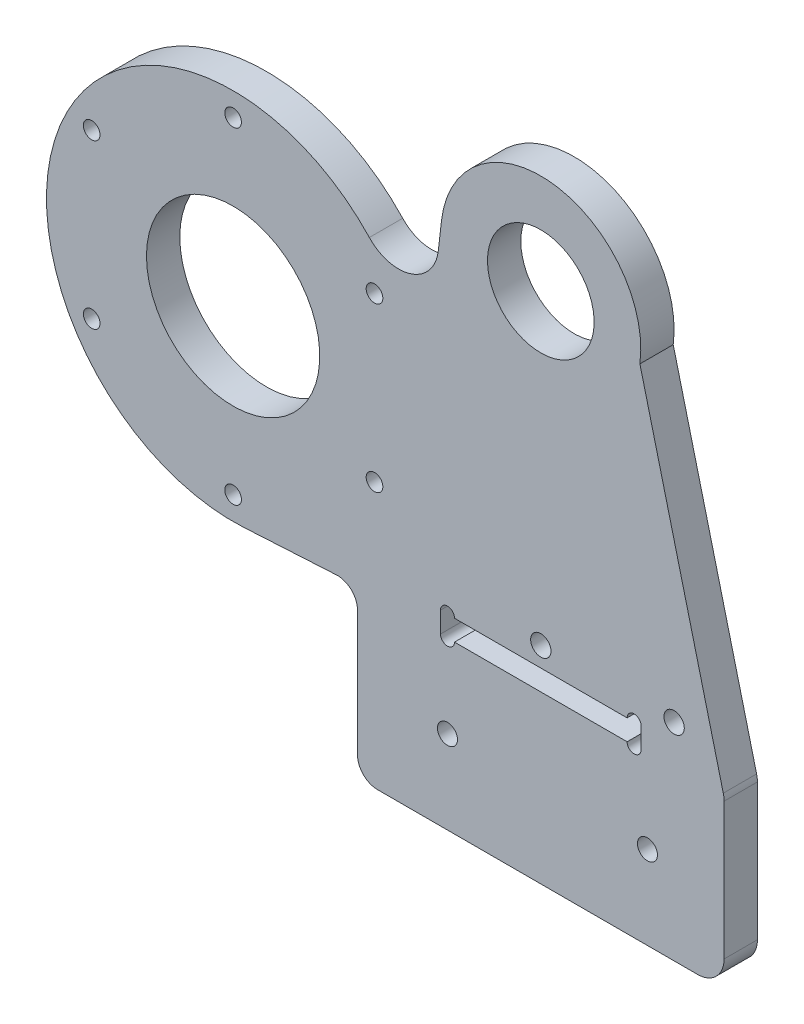
from build123d import *

# Parameters (mm, degrees)
SKETCH_1_W           = 40
SKETCH_1_H           = 25
EXTRUDE_1_DEPTH      = 5
SKETCH_2_W           = 25
SKETCH_2_H           = 62
EXTRUDE_2_DEPTH      = 5
SKETCH_3_R           = 8
CUT_EXTRUDE_1_DEPTH  = 14
EXTRUDE_3_DEPTH      = 5
EXTRUDE_4_DEPTH      = 5
SKETCH_6_R           = 1.25
CUT_EXTRUDE_2_DEPTH  = 10
SKETCH_7_R           = 13
CUT_EXTRUDE_3_DEPTH  = 10
FILLET_1_R           = 3
EXTRUDE_6_DEPTH      = 5
FILLET_5_R           = 4
SKETCH_12_R          = 15
SKETCH_12_R_2        = 8
EXTRUDE_7_DEPTH      = 5
CUT_EXTRUDE_6_DEPTH  = 10
SKETCH_14_W          = 30.1
SKETCH_14_H          = 3.1
CUT_EXTRUDE_7_DEPTH  = 5
SKETCH_15_R          = 1.05
CUT_EXTRUDE_8_DEPTH  = 5
SKETCH_18_R          = 1.5
CUT_EXTRUDE_12_DEPTH = 10
SKETCH_20_R          = 1.525
CUT_EXTRUDE_14_DEPTH = 10


with BuildPart() as part:
    # 草图1 → 凸台-拉伸1 (new body)
    with BuildSketch(Plane.XY):
        Rectangle(SKETCH_1_W, SKETCH_1_H)
    extrude(amount=EXTRUDE_1_DEPTH)

    # 草图2 → 凸台-拉伸2 (add)
    with BuildSketch(Plane.XY.offset(5)):
        with Locations((7.5, 43.5)):
            Rectangle(SKETCH_2_W, SKETCH_2_H)
    extrude(amount=-EXTRUDE_2_DEPTH)

    # 草图3 → 切除-拉伸1 (cut)
    with BuildSketch(Plane(origin=(0, 0, 0), x_dir=(-1, 0, 0), z_dir=(0, 0, -1))):
        with Locations((-7.5, 64.5)):
            Circle(SKETCH_3_R)
    extrude(amount=-CUT_EXTRUDE_1_DEPTH, mode=Mode.SUBTRACT)

    # 草图4 → 凸台-拉伸3 (add)
    with BuildSketch(Plane(origin=(0, 0, 0), x_dir=(-1, 0, 0), z_dir=(0, 0, -1))):
        Polygon((5, 74.5), (20, 12.5), (5, 12.5), align=None)
    extrude(amount=-EXTRUDE_3_DEPTH)

    # 草图5 → 凸台-拉伸4 (add)
    with BuildSketch(Plane(origin=(0, 0, 0), x_dir=(-1, 0, 0), z_dir=(0, 0, -1))):
        with BuildLine():
            Line((5, 74.5), (43.961916065, 66.994501049))
            ThreePointArc((43.961916065, 66.994501049), (66.453639267, 36.062373582), (37.102191657, 11.543673671))
            Line((37.102191657, 11.543673671), (20, 12.5))
            Line((20, 12.5), (5, 74.5))
        make_face()
    extrude(amount=-EXTRUDE_4_DEPTH)

    # 草图6 → 切除-拉伸2 (cut)
    with BuildSketch(Plane(origin=(0, 0, 0), x_dir=(-1, 0, 0), z_dir=(0, 0, -1))):
        with Locations((38.665463282, 64)):
            Circle(SKETCH_6_R)
        with Locations((59.883085674, 51.75)):
            Circle(SKETCH_6_R)
        with Locations((59.883085674, 27.25)):
            Circle(SKETCH_6_R)
        with Locations((38.665463282, 15)):
            Circle(SKETCH_6_R)
        with Locations((17.447840889, 27.25)):
            Circle(SKETCH_6_R)
        with Locations((17.447840889, 51.75)):
            Circle(SKETCH_6_R)
    extrude(amount=-CUT_EXTRUDE_2_DEPTH, mode=Mode.SUBTRACT)

    # 草图7 → 切除-拉伸3 (cut)
    with BuildSketch(Plane(origin=(0, 0, 0), x_dir=(-1, 0, 0), z_dir=(0, 0, -1))):
        with Locations((38.665463282, 39.5)):
            Circle(SKETCH_7_R)
    extrude(amount=-CUT_EXTRUDE_3_DEPTH, mode=Mode.SUBTRACT)

    # 圆角1
    fillet_1_edges = [part.edges().sort_by_distance(p)[0] for p in [
        (20, 74.5, 2.5),
        (20, -12.5, 2.5),
        (-20, -12.5, 2.5),
        (-20, 12.5, 2.5),
    ]]
    fillet(fillet_1_edges, radius=FILLET_1_R)

    # 草图9 → 凸台-拉伸6 (add)
    with BuildSketch(Plane(origin=(0, 0, 0), x_dir=(-1, 0, 0), z_dir=(0, 0, -1))):
        Polygon((-17, -12.5), (-35, -12.5), (-35, 12.5), (-19.908611993, 72.234830778), align=None)
    extrude(amount=-EXTRUDE_6_DEPTH)

    # 圆角5
    fillet_5_edges = [part.edges().sort_by_distance(p)[0] for p in [
        (35, -12.5, 2.5),
        (35, 12.5, 2.5),
    ]]
    fillet(fillet_5_edges, radius=FILLET_5_R)

    # 草图12 → 凸台-拉伸7 (add)
    with BuildSketch(Plane(origin=(0, 0, 0), x_dir=(-1, 0, 0), z_dir=(0, 0, -1))):
        with Locations((-7.5, 64.5)):
            Circle(SKETCH_12_R)
        with Locations((-7.5, 64.5)):
            Circle(SKETCH_12_R_2, mode=Mode.SUBTRACT)
    extrude(amount=-EXTRUDE_7_DEPTH)

    # 草图13 → 切除-拉伸6 (cut)
    with BuildSketch(Plane(origin=(0, 0, 0), x_dir=(-1, 0, 0), z_dir=(0, 0, -1))):
        with BuildLine():
            Line((7.401386096, 66.217175707), (7.881923771, 62.047143837))
            ThreePointArc((7.881923771, 62.047143837), (11.961869133, 57.036355872), (18.223004987, 58.633893981))
            ThreePointArc((18.223004987, 58.633893981), (30.76141934, 66.361237674), (45.486790657, 66.65638954))
            Line((45.486790657, 66.65638954), (-3.845717477, 79.048065825))
            ThreePointArc((-3.845717477, 79.048065825), (3.779900034, 74.38756063), (7.401386096, 66.217175707))
        make_face()
    extrude(amount=-CUT_EXTRUDE_6_DEPTH, mode=Mode.SUBTRACT)

    # 草图14 → 切除-拉伸7 (cut)
    with BuildSketch(Plane.XY.offset(5)):
        with Locations((7.5, 14)):
            Rectangle(SKETCH_14_W, SKETCH_14_H)
    extrude(amount=-CUT_EXTRUDE_7_DEPTH, mode=Mode.SUBTRACT)

    # 草图15 → 切除-拉伸8 (cut)
    with BuildSketch(Plane.XY.offset(5)):
        with Locations((-6.5, 15.55)):
            Circle(SKETCH_15_R)
        with Locations((21.5, 15.55)):
            Circle(SKETCH_15_R)
        with Locations((-6.5, 12.45)):
            Circle(SKETCH_15_R)
        with Locations((21.5, 12.45)):
            Circle(SKETCH_15_R)
    extrude(amount=-CUT_EXTRUDE_8_DEPTH, mode=Mode.SUBTRACT)

    # 草图18 → 切除-拉伸12 (cut)
    with BuildSketch(Plane(origin=(0, 0, 0), x_dir=(-1, 0, 0), z_dir=(0, 0, -1))):
        with Locations((-23.5, 0)):
            Circle(SKETCH_18_R)
        with Locations((6.5, 0)):
            Circle(SKETCH_18_R)
    extrude(amount=-CUT_EXTRUDE_12_DEPTH, mode=Mode.SUBTRACT)

    # 草图20 → 切除-拉伸14 (cut)
    with BuildSketch(Plane(origin=(0, 0, 0), x_dir=(-1, 0, 0), z_dir=(0, 0, -1))):
        with Locations((-27.5, 18.5)):
            Circle(SKETCH_20_R)
        with Locations((-7.5, 18.5)):
            Circle(SKETCH_20_R)
    extrude(amount=-CUT_EXTRUDE_14_DEPTH, mode=Mode.SUBTRACT)


solid = part.part
